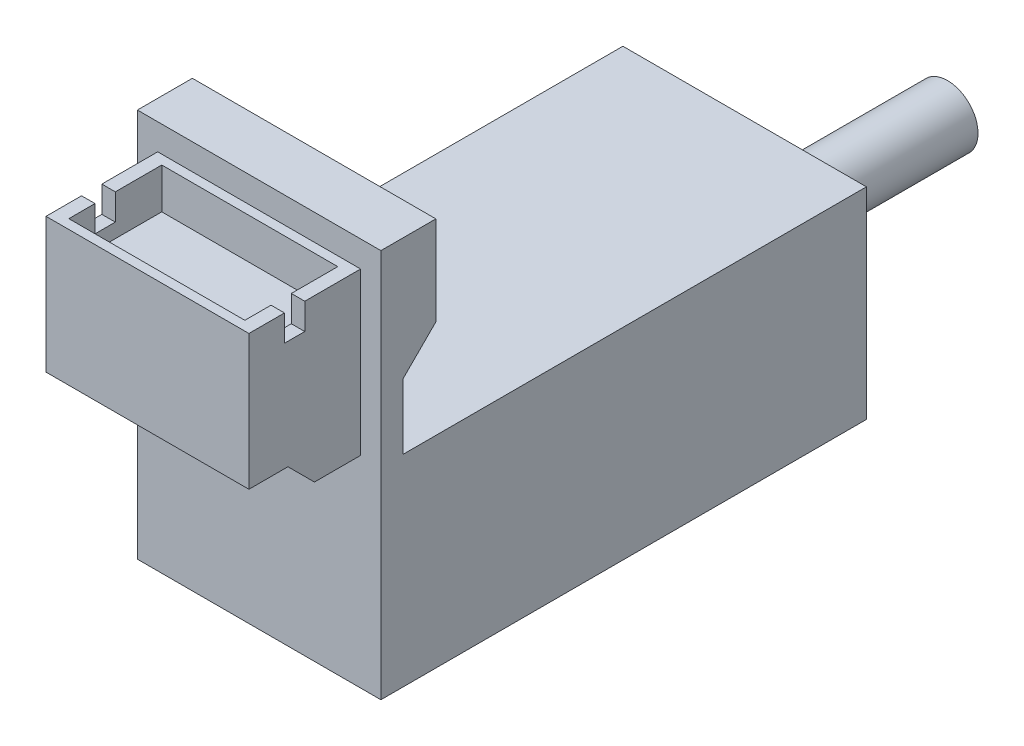
from build123d import *

# Parameters (mm, degrees)
BOSS_EXTRUDE2_DEPTH = 12
SKETCH2_R           = 2
BOSS_EXTRUDE3_DEPTH = 1
SKETCH3_R           = 1.5
BOSS_EXTRUDE4_DEPTH = 9
CUT_EXTRUDE1_START  = -9
CUT_EXTRUDE1_DEPTH  = 9
SKETCH5_W           = 1
SKETCH5_H           = 5.504032185
CUT_EXTRUDE2_DEPTH  = 35.052899636
SKETCH6_W           = 1
SKETCH6_H           = 1.293248053
CUT_EXTRUDE3_DEPTH  = 32.913534796
SKETCH7_W           = 8.674818334
SKETCH7_H           = 4.580598429
CUT_EXTRUDE4_DEPTH  = 2


with BuildPart() as part:
    # Sketch1 → Boss-Extrude2 (new body)
    with BuildSketch(Plane(origin=(0, 0, 0), x_dir=(0, 0, -1), z_dir=(1, 0, 0))):
        Polygon((7.575967815, 4.965), (-6.46289635, 4.965), (-6.46289635, 8.187263597), (-4.840898274, 9.809261674), (-4.840898274, 14.205), (-7.55, 14.205), (-7.55, 12.920980416), (-13.054032185, 12.920980416), (-13.054032185, 6.270822131), (-11.130968968, 6.270822131), (-9.825146836, 4.965), (-7.55, 4.965), (-7.55, -4.965), (7.55, -4.965), (16.375967815, -4.965), (16.375967815, 4.965), align=None)
    extrude(amount=BOSS_EXTRUDE2_DEPTH)

    # Sketch2 → Boss-Extrude3 (add)
    with BuildSketch(Plane(origin=(0, 0, -16.375967815), x_dir=(-1, 0, 0), z_dir=(0, 0, -1))):
        with Locations((-6, 0)):
            Circle(SKETCH2_R)
    extrude(amount=BOSS_EXTRUDE3_DEPTH)

    # Sketch3 → Boss-Extrude4 (add)
    with BuildSketch(Plane(origin=(0, 0, -17.375967815), x_dir=(-1, 0, 0), z_dir=(0, 0, -1))):
        with Locations((-6, 0)):
            Circle(SKETCH3_R)
    extrude(amount=BOSS_EXTRUDE4_DEPTH)

    # Sketch4 → Cut-Extrude1 (cut)
    with BuildSketch(Plane(origin=(0, 0, -26.375967815), x_dir=(-1, 0, 0), z_dir=(0, 0, -1)).offset(CUT_EXTRUDE1_START)):
        with BuildLine():
            Line((-6.839845518, -1.242843315), (-5.160154482, -1.242843315))
            ThreePointArc((-5.160154482, -1.242843315), (-6, -1.5), (-6.839845518, -1.242843315))
        make_face()
    extrude(amount=CUT_EXTRUDE1_DEPTH, mode=Mode.SUBTRACT)

    # Sketch5 → Cut-Extrude2 (cut, through all)
    with BuildSketch(Plane(origin=(0, 12.920980416, 0), x_dir=(1, 0, 0), z_dir=(0, 1, 0))):
        with Locations((11.5, -10.302016093)):
            Rectangle(SKETCH5_W, SKETCH5_H)
        with Locations((0.5, -10.302016093)):
            Rectangle(SKETCH5_W, SKETCH5_H)
    extrude(amount=-CUT_EXTRUDE2_DEPTH, mode=Mode.SUBTRACT)

    # Sketch6 → Cut-Extrude3 (cut, through all)
    with BuildSketch(Plane(origin=(11, 0, 0), x_dir=(0, 0, -1), z_dir=(1, 0, 0))):
        with Locations((-10.802016092, 12.27435639)):
            Rectangle(SKETCH6_W, SKETCH6_H)
    extrude(amount=-CUT_EXTRUDE3_DEPTH, mode=Mode.SUBTRACT)

    # Sketch7 → Cut-Extrude4 (cut)
    with BuildSketch(Plane(origin=(0, 12.920980416, 0), x_dir=(1, 0, 0), z_dir=(0, 1, 0))):
        with Locations((6, -10.302016093)):
            Rectangle(SKETCH7_W, SKETCH7_H)
    extrude(amount=-CUT_EXTRUDE4_DEPTH, mode=Mode.SUBTRACT)


solid = part.part
